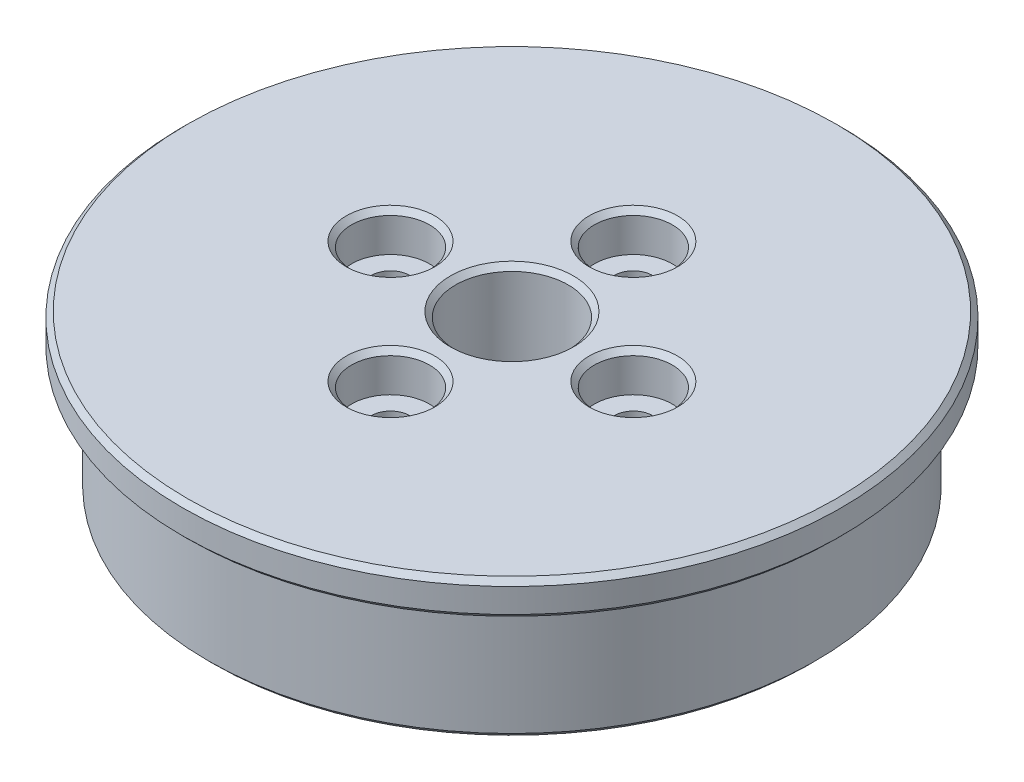
from build123d import *

# Parameters (mm, degrees)
SKETCH_1_R          = 19
EXTRUDE_1_DEPTH     = 10.45
SKETCH_2_R          = 35.878367213
SKETCH_2_R_2        = 10
CUT_EXTRUDE_1_DEPTH = 1.45
SKETCH_2_3_R        = 35.878367213
SKETCH_2_3_R_2      = 17.5
CUT_EXTRUDE_2_DEPTH = 8.45
SKETCH_3_R          = 3.25
SKETCH_3_R_2        = 1.1
CUT_EXTRUDE_3_DEPTH = 29.83058272
CUT_EXTRUDE_START   = 8.2
SKETCH_3_3_R        = 2.25
CUT_EXTRUDE_4_DEPTH = 21.63058272
SKETCH_4_R          = 16
SKETCH_4_R_2        = 10
CUT_EXTRUDE_5_DEPTH = 2.2
SKETCH_5_R          = 4.5
CUT_EXTRUDE_6_DEPTH = 2
CHAMFER_1_SIZE      = 0.3


with BuildPart() as part:
    # Эскиз1 → Бобышка-Вытянуть1 (new body)
    with BuildSketch(Plane(origin=(0, 0, 0), x_dir=(1, 0, 0), z_dir=(0, 1, 0))):
        Circle(SKETCH_1_R)
    extrude(amount=EXTRUDE_1_DEPTH)

    # Эскиз2 → Вырез-Вытянуть1 (cut)
    with BuildSketch(Plane(origin=(0, 0, 0), x_dir=(1, 0, 0), z_dir=(0, 1, 0))):
        Circle(SKETCH_2_R)
        Circle(SKETCH_2_R_2, mode=Mode.SUBTRACT)
    extrude(amount=CUT_EXTRUDE_1_DEPTH, mode=Mode.SUBTRACT)

    # Эскиз2<3> → Вырез-Вытянуть2 (cut)
    with BuildSketch(Plane(origin=(0, 0, 0), x_dir=(1, 0, 0), z_dir=(0, 1, 0))):
        Circle(SKETCH_2_3_R)
        Circle(SKETCH_2_3_R_2, mode=Mode.SUBTRACT)
    extrude(amount=CUT_EXTRUDE_2_DEPTH, mode=Mode.SUBTRACT)

    # Эскиз3 → Вырез-Вытянуть3 (cut, through all)
    with BuildSketch(Plane(origin=(0, 0, 0), x_dir=(1, 0, 0), z_dir=(0, 1, 0))):
        Circle(SKETCH_3_R)
        with Locations((0, 7)):
            Circle(SKETCH_3_R_2)
        with Locations((-7, 0)):
            Circle(SKETCH_3_R_2)
        with Locations((0, -7)):
            Circle(SKETCH_3_R_2)
        with Locations((7, 0)):
            Circle(SKETCH_3_R_2)
    extrude(amount=CUT_EXTRUDE_3_DEPTH, mode=Mode.SUBTRACT)

    # Эскиз3<3> → Вырез-Вытянуть4 (cut, through all)
    with BuildSketch(Plane(origin=(0, 0, 0), x_dir=(1, 0, 0), z_dir=(0, 1, 0)).offset(CUT_EXTRUDE_START)):
        with Locations((0, 7)):
            Circle(SKETCH_3_3_R)
        with Locations((7, 0)):
            Circle(SKETCH_3_3_R)
        with Locations((0, -7)):
            Circle(SKETCH_3_3_R)
        with Locations((-7, 0)):
            Circle(SKETCH_3_3_R)
    extrude(amount=CUT_EXTRUDE_4_DEPTH, mode=Mode.SUBTRACT)

    # Эскиз4 → Вырез-Вытянуть5 (cut)
    with BuildSketch(Plane(origin=(0, 0, 0), x_dir=(1, 0, 0), z_dir=(0, 1, 0))):
        Circle(SKETCH_4_R)
        Circle(SKETCH_4_R_2, mode=Mode.SUBTRACT)
    extrude(amount=CUT_EXTRUDE_5_DEPTH, mode=Mode.SUBTRACT)

    # Эскиз5 → Вырез-Вытянуть6 (cut)
    with BuildSketch(Plane(origin=(0, 0, 0), x_dir=(1, 0, 0), z_dir=(0, 1, 0))):
        Circle(SKETCH_5_R)
    extrude(amount=CUT_EXTRUDE_6_DEPTH, mode=Mode.SUBTRACT)

    # Фаска1
    chamfer_1_edges = [part.edges().sort_by_distance(p)[0] for p in [
        (-19, 10.45, 0),
        (-3.25, 10.45, 0),
        (-2.25, 10.45, 7),
        (4.75, 10.45, 0),
        (-2.25, 10.45, -7),
        (-9.25, 10.45, 0),
        (-17.5, 1.45, 0),
        (-19, 8.45, 0),
        (-4.5, 0, 0),
    ]]
    chamfer(chamfer_1_edges, length=CHAMFER_1_SIZE)


solid = part.part
